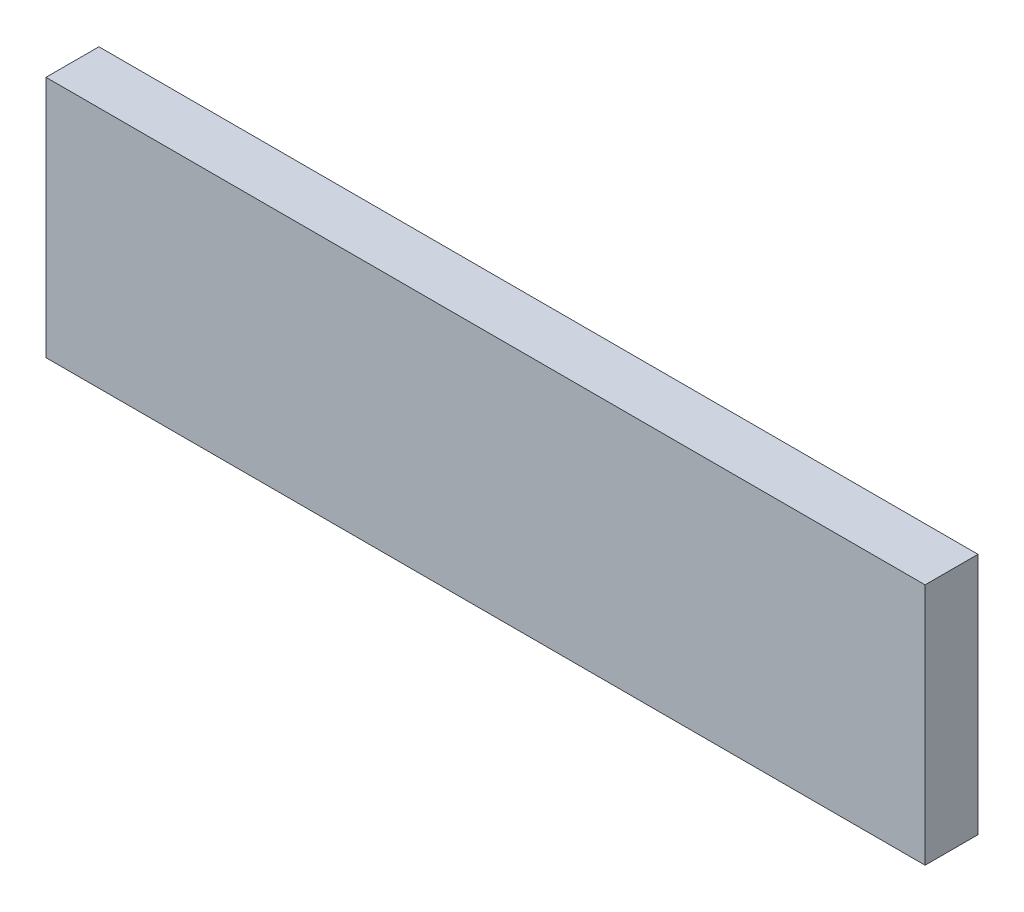
from build123d import *

# Parameters (mm, degrees)
DET_PU_DILIMI_ARKA_1_START = -758.5
SKETCH1_W                  = 648
SKETCH1_H                  = 179
DET_PU_DILIMI_ARKA_1_DEPTH = 39


with BuildPart() as part:
    # Sketch1 → DET_PU_dilimi_arka_1 (new body)
    with BuildSketch(Plane.XY.offset(DET_PU_DILIMI_ARKA_1_START)):
        with Locations((1026, 1558.5)):
            Rectangle(SKETCH1_W, SKETCH1_H)
    extrude(amount=-DET_PU_DILIMI_ARKA_1_DEPTH)


solid = part.part
